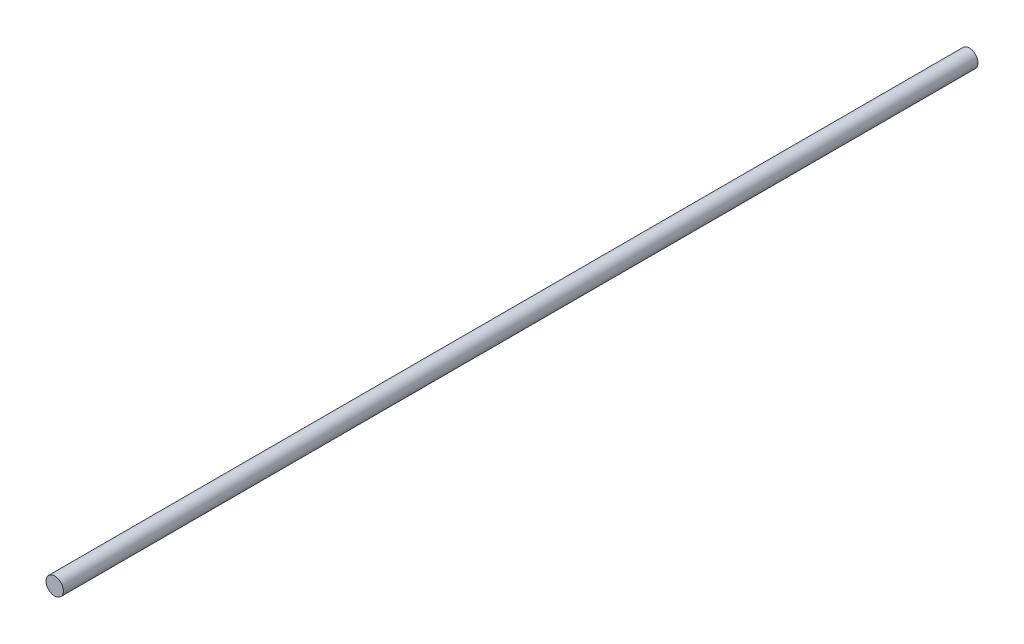
from build123d import *

# Parameters (mm, degrees)
SKETCH2_W = 420.400000948
SKETCH2_H = 4


with BuildPart() as part:
    # Sketch2 → Revolve1 (revolve)
    with BuildSketch(Plane(origin=(0, 0, 0), x_dir=(0, 0, -1), z_dir=(1, 0, 0)), mode=Mode.PRIVATE) as revolve1_sk:
        with Locations((191.1, 2)):
            Rectangle(SKETCH2_W, SKETCH2_H)
    revolve(revolve1_sk.sketch.rotate(Axis((0, 0, 19.100000474), (0, 0, -1)), 90), axis=Axis((0, 0, 19.100000474), (0, 0, -1)))


solid = part.part
